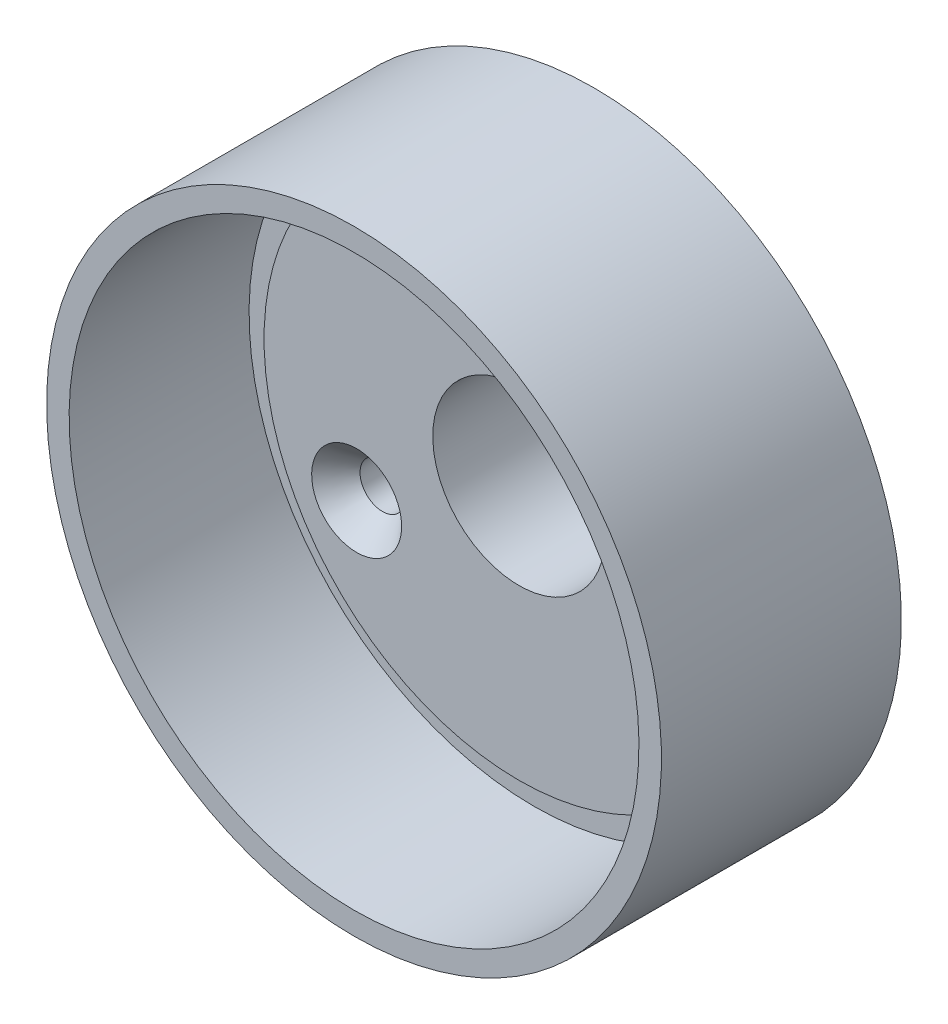
from build123d import *

# Parameters (mm, degrees)
ESQUISSE3_R                                       = 18.25625
ENL_V_MAT_EXTRU_1_DEPTH                           = 120.495628843
FRAISAGE_POUR_VIS_T_TE_FRAIS_E_BOMB_E_D           = 9.525
FRAISAGE_POUR_VIS_T_TE_FRAIS_E_BOMB_E_CSINK_D     = 19.05
FRAISAGE_POUR_VIS_T_TE_FRAIS_E_BOMB_E_CSINK_ANGLE = 82
R_P_TITION_CIRCULAIRE1_COUNT                      = 3
CHANFREIN1_SIZE                                   = 1.5875
ESQUISSE7_W                                       = 5.35813
ESQUISSE7_H                                       = 65.0875


with BuildPart() as part:
    # Esquisse2 → Révolution2 (revolve)
    with BuildSketch(Plane(origin=(0, 0, 0), x_dir=(0, 0, -1), z_dir=(1, 0, 0)), mode=Mode.PRIVATE) as r_volution2_sk:
        Polygon((0, 0), (0, 26.19375), (-25.4, 26.19375), (-25.4, 65.0875), (-76.2, 65.0875), (-76.2, 60.325), (-38.1, 60.325), (-38.1, 53.975), (-41.275, 53.975), (-41.275, 0), align=None)
    revolve(r_volution2_sk.sketch.rotate(Axis((0, 0, 41.275), (0, 0, -1)), 180), axis=Axis((0, 0, 41.275), (0, 0, -1)))

    # Esquisse3 → Enlèv. mat.-Extru.1 (cut, through all)
    with BuildSketch(Plane(origin=(0, 0, 0), x_dir=(-1, 0, 0), z_dir=(0, 0, -1))):
        with Locations(Location((0, 0, 0), (0, 0, 90))):
            Circle(ESQUISSE3_R)
    extrude(amount=-ENL_V_MAT_EXTRU_1_DEPTH, mode=Mode.SUBTRACT)

    # Fraisage pour vis à tête fraisée bombée 3/81 (through all)
    with Locations(Plane.XY.offset(41.275)):
        with Locations((0, 39.6875)):
            fraisage_pour_vis_t_te_frais_e_bomb_e = CounterSinkHole(FRAISAGE_POUR_VIS_T_TE_FRAIS_E_BOMB_E_D / 2, FRAISAGE_POUR_VIS_T_TE_FRAIS_E_BOMB_E_CSINK_D / 2, counter_sink_angle=FRAISAGE_POUR_VIS_T_TE_FRAIS_E_BOMB_E_CSINK_ANGLE)

    # Répétition circulaire1: Fraisage pour vis à tête fraisée bombée 3/81 ×3 about axis
    r_p_tition_circulaire1_axis = Axis((0, 0, 0), (0, 0, 1))
    for i in range(1, R_P_TITION_CIRCULAIRE1_COUNT):
        add(fraisage_pour_vis_t_te_frais_e_bomb_e.rotate(r_p_tition_circulaire1_axis, i * 360 / R_P_TITION_CIRCULAIRE1_COUNT), mode=Mode.SUBTRACT)

    # Chanfrein1
    chanfrein1_edges = [part.edges().sort_by_distance(p)[0] for p in [
        (0, 26.19375, 0),
    ]]
    chamfer(chanfrein1_edges, length=CHANFREIN1_SIZE)

    # Esquisse7 → Trou taraudé 1/2-131 (revolve, cut)
    with BuildSketch(Plane(origin=(0, 0, 12.7), x_dir=(0, 0, -1), z_dir=(1, 0, 0))):
        with Locations((2.679065, 32.54375)):
            Rectangle(ESQUISSE7_W, ESQUISSE7_H)
    revolve(axis=Axis((0, -6.35, 12.7), (0, 1, 0)), mode=Mode.SUBTRACT)


solid = part.part
